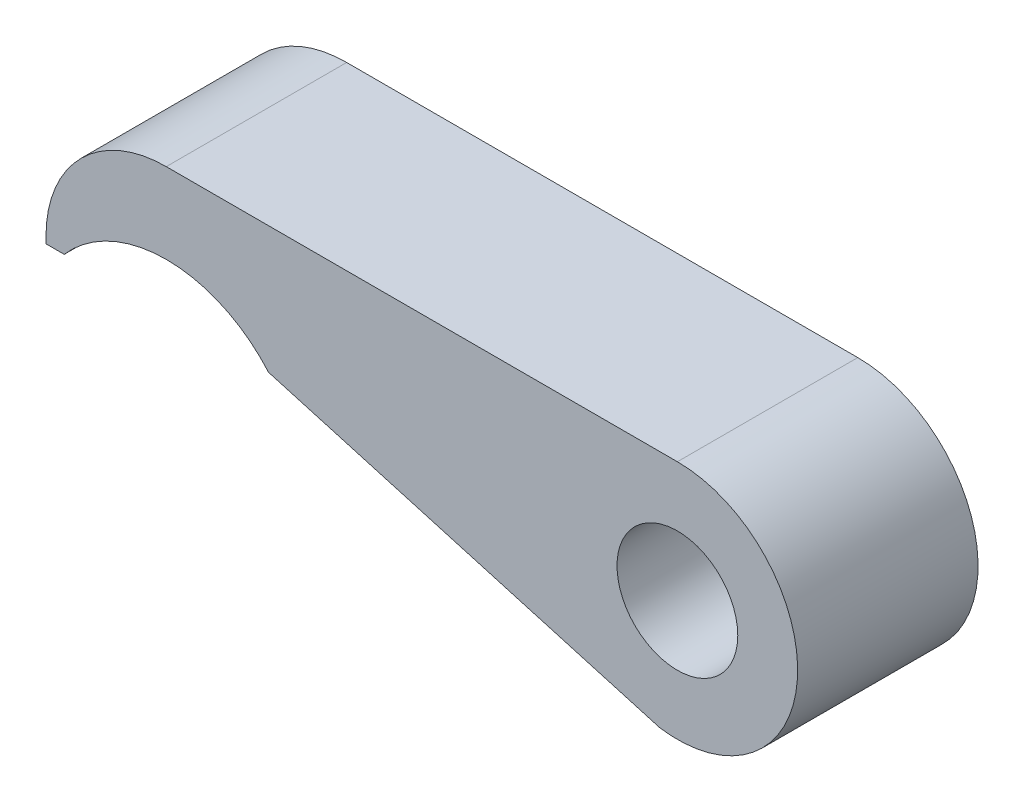
from build123d import *

# Parameters (mm, degrees)
SKETCH1_R           = 3.1877
BOSS_EXTRUDE1_DEPTH = 9.525


with BuildPart() as part:
    # Sketch1 → Boss-Extrude1 (new body)
    with BuildSketch(Plane.XY):
        with BuildLine():
            Line((-19.84375, -1.016), (-18.881836189, -1.016))
            ThreePointArc((-18.881836189, -1.016), (-13.4874, 1.4478), (-8.092963811, -1.016))
            Line((-8.092963811, -1.016), (12.583078625, -6.944759764))
            ThreePointArc((12.583078625, -6.944759764), (19.827318682, -1.116916975), (13.49375, 5.6896))
            Line((13.49375, 5.6896), (-13.49375, 5.6896))
            ThreePointArc((-13.49375, 5.6896), (-17.983878061, 3.829728061), (-19.84375, -0.6604))
            Line((-19.84375, -0.6604), (-19.84375, -1.016))
        make_face()
        with Locations((13.49375, -0.6604)):
            Circle(SKETCH1_R, mode=Mode.SUBTRACT)
    extrude(amount=-BOSS_EXTRUDE1_DEPTH)


solid = part.part
